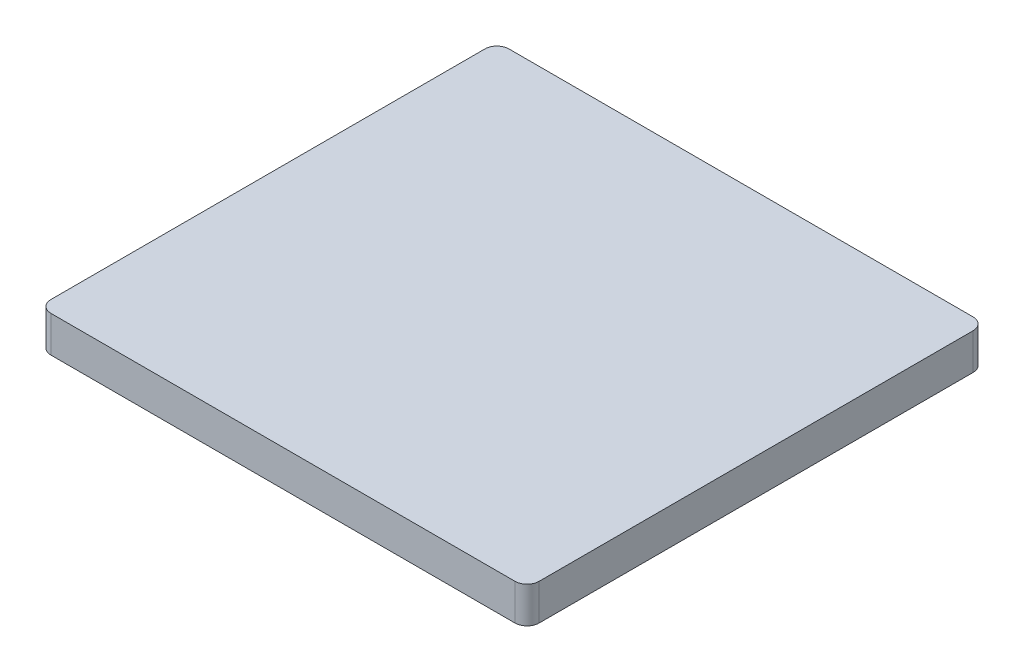
from build123d import *

# Parameters (mm, degrees)
SKETCH_1_W         = 81
SKETCH_1_H         = 6
BLOCKEXTRUDE_DEPTH = 76
FILLET_2_R         = 2


with BuildPart() as part:
    # 草图1 → BlockExtrude (new body)
    with BuildSketch(Plane.XY):
        with Locations((40.5, 3)):
            Rectangle(SKETCH_1_W, SKETCH_1_H)
    extrude(amount=BLOCKEXTRUDE_DEPTH)

    # Fillet 2
    fillet_2_edges = [part.edges().sort_by_distance(p)[0] for p in [
        (81, 3, 76),
        (0, 3, 76),
        (81, 3, 0),
        (0, 3, 0),
    ]]
    fillet(fillet_2_edges, radius=FILLET_2_R)


solid = part.part
